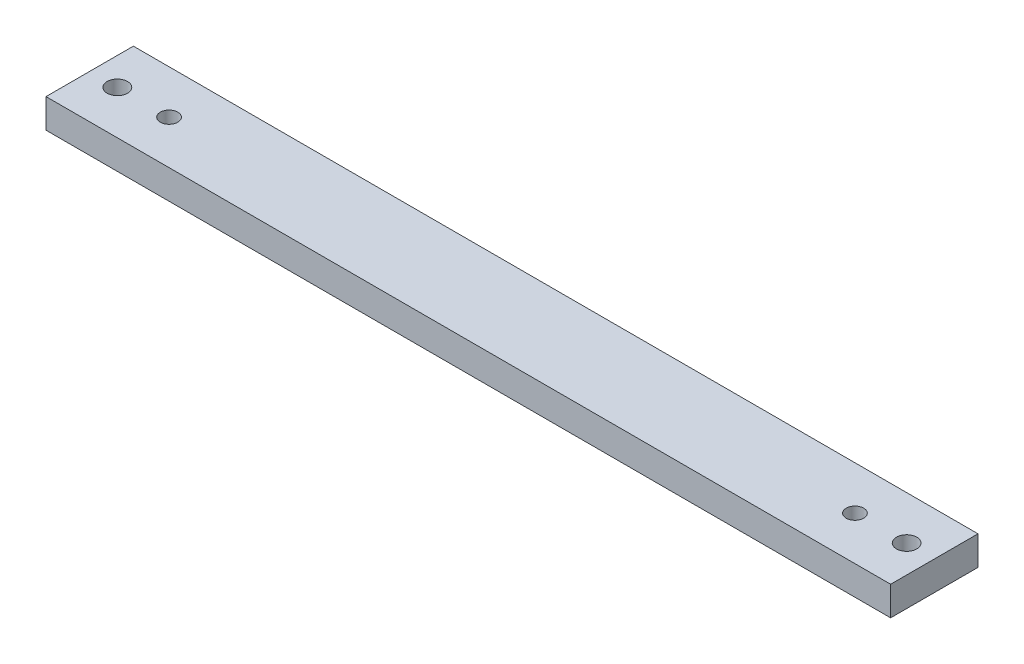
from build123d import *

# Parameters (mm, degrees)
SKETCH3_W           = 580
SKETCH3_H           = 60
BOSS_EXTRUDE1_DEPTH = 20
SKETCH4_R           = 7
SKETCH4_R_2         = 6
CUT_EXTRUDE1_DEPTH  = 586.832740635


with BuildPart() as part:
    # Sketch3 → Boss-Extrude1 (new body)
    with BuildSketch(Plane(origin=(0, 0, 0), x_dir=(1, 0, 0), z_dir=(0, 1, 0))):
        with Locations((290, 50)):
            Rectangle(SKETCH3_W, SKETCH3_H)
    extrude(amount=BOSS_EXTRUDE1_DEPTH)

    # Sketch4 → Cut-Extrude1 (cut, through all)
    with BuildSketch(Plane(origin=(0, 20, 0), x_dir=(1, 0, 0), z_dir=(0, 1, 0))):
        with Locations(Location((19, 50, 0), (0, 0, 270))):
            Circle(SKETCH4_R)
        with Locations(Location((54.5, 50, 0), (0, 0, 270))):
            Circle(SKETCH4_R_2)
        with Locations(Location((525.5, 50, 0), (0, 0, 270))):
            Circle(SKETCH4_R_2)
        with Locations(Location((561, 50, 0), (0, 0, 270))):
            Circle(SKETCH4_R)
    extrude(amount=-CUT_EXTRUDE1_DEPTH, mode=Mode.SUBTRACT)


solid = part.part
